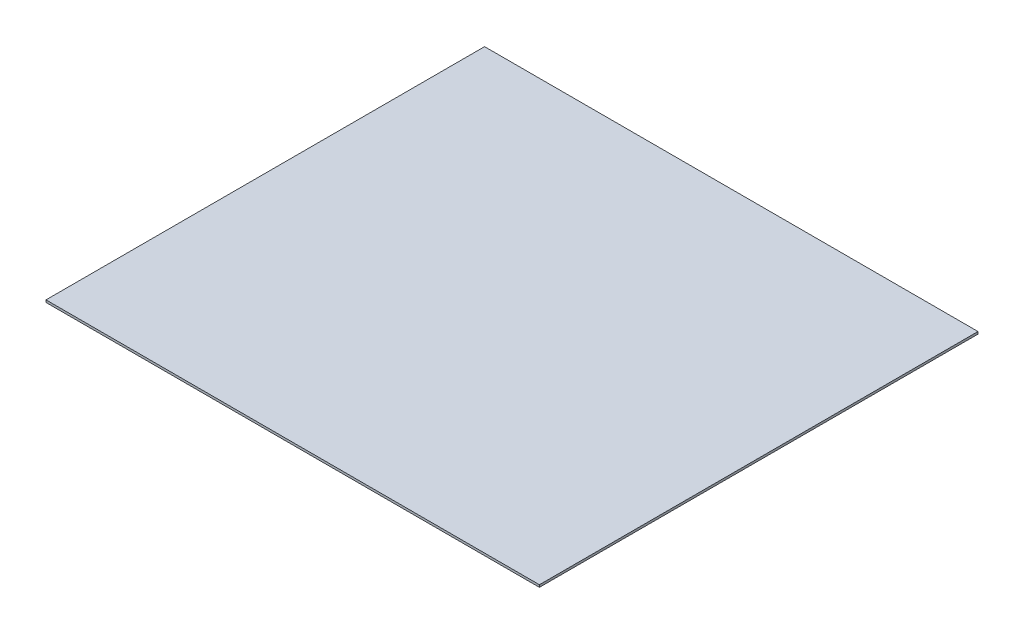
from build123d import *

# Parameters (mm, degrees)
SKETCH1_W           = 685.8
SKETCH1_H           = 609.6
BOSS_EXTRUDE1_DEPTH = 3.175


with BuildPart() as part:
    # Sketch1 → Boss-Extrude1 (new body)
    with BuildSketch(Plane(origin=(0, 0, 0), x_dir=(1, 0, 0), z_dir=(0, 1, 0))):
        with Locations((0, 12.146559633)):
            Rectangle(SKETCH1_W, SKETCH1_H)
    extrude(amount=BOSS_EXTRUDE1_DEPTH)


solid = part.part
